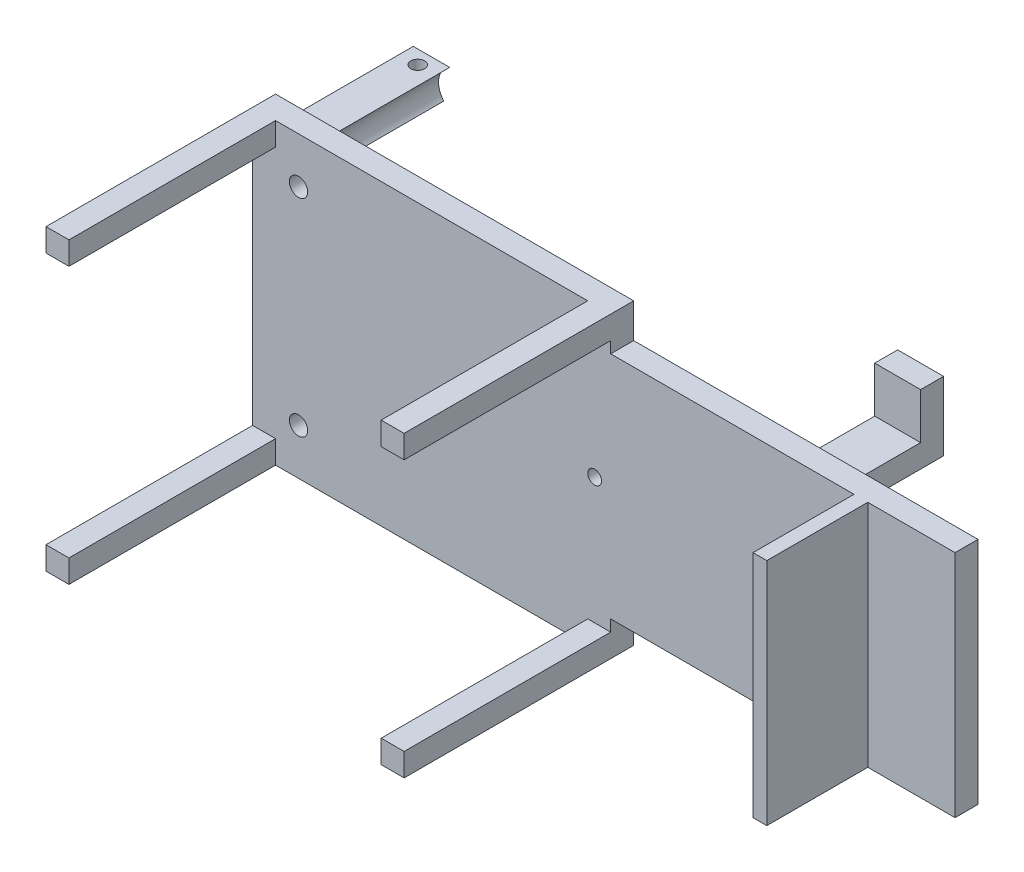
from build123d import *

# Parameters (mm, degrees)
CROQUIS1_R               = 2
CROQUIS1_R_2             = 1.5
CROQUIS1_W               = 75
CROQUIS1_H               = 50
SALIENTE_EXTRUIR4_DEPTH  = 5
CROQUIS3_W               = 5
CROQUIS3_H               = 5
SALIENTE_EXTRUIR5_DEPTH  = 50
CROQUIS4_W               = 3
CROQUIS4_H               = 50
SALIENTE_EXTRUIR7_DEPTH  = 22
SALIENTE_EXTRUIR9_DEPTH  = 27.5
CROQUIS7_W               = 10
CROQUIS7_H               = 5
SALIENTE_EXTRUIR10_DEPTH = 10
CROQUIS8_W               = 10
CROQUIS8_H               = 5
SALIENTE_EXTRUIR11_DEPTH = 10
SALIENTE_EXTRUIR12_DEPTH = 30
CROQUIS10_R              = 1.5
CORTAR_EXTRUIR1_DEPTH    = 77


with BuildPart() as part:
    # Croquis1 → Saliente-Extruir4 (new body)
    # profile 1 of 2: a face of its own
    with BuildSketch(Plane.XY):
        Polygon((-71.5, -27.5), (-71.5, -32.5), (-3.5, -32.5), (-3.5, -27.5), (1.5, -27.5), (1.5, -25), (1.5, 25), (1.5, 27.5), (-3.5, 27.5), (-3.5, 32.5), (-71.5, 32.5), (-71.5, 27.5), (-76.5, 27.5), (-76.5, -27.5), align=None)
        with Locations((-66.5, -22.5)):
            Circle(CROQUIS1_R, mode=Mode.SUBTRACT)
        with Locations((-2, 0)):
            Circle(CROQUIS1_R_2, mode=Mode.SUBTRACT)
        with Locations((-66.5, 22.5)):
            Circle(CROQUIS1_R, mode=Mode.SUBTRACT)
    # profile 2 of 2: a face of its own
    with BuildSketch(Plane.XY):
        with Locations((39, 0)):
            Rectangle(CROQUIS1_W, CROQUIS1_H)
    extrude(amount=SALIENTE_EXTRUIR4_DEPTH)

    # Croquis3 → Saliente-Extruir5 (add)
    with BuildSketch(Plane(origin=(0, 0, 0), x_dir=(-1, 0, 0), z_dir=(0, 0, -1))):
        with Locations((74, 30)):
            Rectangle(CROQUIS3_W, CROQUIS3_H)
        with Locations((1, -30)):
            Rectangle(CROQUIS3_W, CROQUIS3_H)
        with Locations((1, 30)):
            Rectangle(CROQUIS3_W, CROQUIS3_H)
        with Locations((74, -30)):
            Rectangle(CROQUIS3_W, CROQUIS3_H)
    extrude(amount=-SALIENTE_EXTRUIR5_DEPTH)

    # Croquis4 → Saliente-Extruir7 (add)
    with BuildSketch(Plane.XY.offset(5)):
        with Locations((56, 0)):
            Rectangle(CROQUIS4_W, CROQUIS4_H)
    extrude(amount=SALIENTE_EXTRUIR7_DEPTH)

    # Croquis6 → Saliente-Extruir9 (add)
    with BuildSketch(Plane(origin=(0, 0, 0), x_dir=(-1, 0, 0), z_dir=(0, 0, -1))):
        Polygon((-31.5, 13.5), (-31.5, 14.5), (-41.5, 14.5), (-41.5, 13.5), (-41.5, 9.5), (-31.5, 9.5), align=None)
        Polygon((-31.5, -13.5), (-31.5, -9.5), (-41.5, -9.5), (-41.5, -13.5), (-41.5, -14.5), (-31.5, -14.5), align=None)
    extrude(amount=SALIENTE_EXTRUIR9_DEPTH)

    # Croquis7 → Saliente-Extruir10 (add)
    with BuildSketch(Plane(origin=(0, 14.5, 0), x_dir=(1, 0, 0), z_dir=(0, 1, 0))):
        with Locations((36.5, 25)):
            Rectangle(CROQUIS7_W, CROQUIS7_H)
    extrude(amount=SALIENTE_EXTRUIR10_DEPTH)

    # Croquis8 → Saliente-Extruir11 (add)
    with BuildSketch(Plane.XZ.offset(14.5)):
        with Locations((36.5, -25)):
            Rectangle(CROQUIS8_W, CROQUIS8_H)
    extrude(amount=SALIENTE_EXTRUIR11_DEPTH)

    # Croquis9 → Saliente-Extruir12 (add)
    with BuildSketch(Plane(origin=(0, 0, 0), x_dir=(-1, 0, 0), z_dir=(0, 0, -1))):
        with BuildLine():
            Line((69.854101966, -19.5), (76.5, -19.5))
            Line((76.5, -19.5), (76.5, -26.5))
            Line((76.5, -26.5), (68.561552813, -26.5))
            ThreePointArc((68.561552813, -26.5), (70.925192558, -23.317111271), (69.854101966, -19.5))
        make_face()
        with BuildLine():
            Line((68.561552813, 26.5), (76.5, 26.5))
            Line((76.5, 26.5), (76.5, 19.5))
            Line((76.5, 19.5), (69.854101966, 19.5))
            ThreePointArc((69.854101966, 19.5), (70.925192558, 23.317111271), (68.561552813, 26.5))
        make_face()
    extrude(amount=SALIENTE_EXTRUIR12_DEPTH)

    # Croquis10 → Cortar-Extruir1 (cut)
    with BuildSketch(Plane(origin=(0, 26.5, 0), x_dir=(1, 0, 0), z_dir=(0, 1, 0))):
        with Locations(Location((-72.530776406, 27, 0), (0, 0, 270))):
            Circle(CROQUIS10_R)
    extrude(amount=-CORTAR_EXTRUIR1_DEPTH, mode=Mode.SUBTRACT)


solid = part.part
